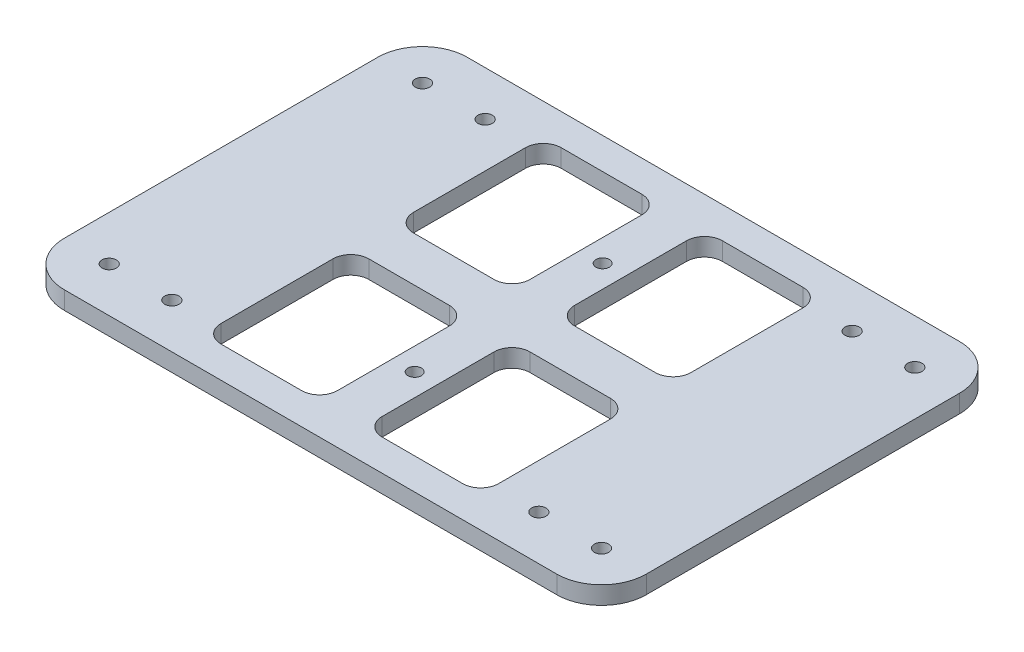
from build123d import *

# Parameters (mm, degrees)
SKETCH2_W           = 130
SKETCH2_H           = 90
BOSS_EXTRUDE1_DEPTH = 4
SKETCH3_R           = 1.5
CUT_EXTRUDE1_DEPTH  = 10
SKETCH4_R           = 1.6
CUT_EXTRUDE2_DEPTH  = 10
FILLET1_R           = 10
CUT_EXTRUDE3_DEPTH  = 10
SKETCH6_R           = 1.5
BOSS_EXTRUDE2_DEPTH = 4
SKETCH7_R           = 1.5
CUT_EXTRUDE4_DEPTH  = 10


with BuildPart() as part:
    # Sketch2 → Boss-Extrude1 (new body)
    with BuildSketch(Plane(origin=(0, 0, 0), x_dir=(1, 0, 0), z_dir=(0, 1, 0))):
        with Locations((71.271186441, 55.564971751)):
            Rectangle(SKETCH2_W, SKETCH2_H)
    extrude(amount=-BOSS_EXTRUDE1_DEPTH)

    # Sketch3 → Cut-Extrude1 (cut)
    with BuildSketch(Plane(origin=(0, 0, 0), x_dir=(1, 0, 0), z_dir=(0, 1, 0))):
        with Locations(Location((126.271186441, 63.564971751, 0), (0, 0, 270))):
            Circle(SKETCH3_R)
        with Locations(Location((126.271186441, 47.564971751, 0), (0, 0, 270))):
            Circle(SKETCH3_R)
        with Locations(Location((112.271186441, 47.564971751, 0), (0, 0, 270))):
            Circle(SKETCH3_R)
        with Locations(Location((112.271186441, 63.564971751, 0), (0, 0, 270))):
            Circle(SKETCH3_R)
        with Locations(Location((16.271186441, 47.564971751, 0), (0, 0, 90))):
            Circle(SKETCH3_R)
        with Locations(Location((30.271186441, 47.564971751, 0), (0, 0, 90))):
            Circle(SKETCH3_R)
        with Locations(Location((16.271186441, 63.564971751, 0), (0, 0, 90))):
            Circle(SKETCH3_R)
        with Locations(Location((30.271186441, 63.564971751, 0), (0, 0, 90))):
            Circle(SKETCH3_R)
    extrude(amount=-CUT_EXTRUDE1_DEPTH, mode=Mode.SUBTRACT)

    # Sketch4 → Cut-Extrude2 (cut)
    with BuildSketch(Plane(origin=(0, 0, 0), x_dir=(1, 0, 0), z_dir=(0, 1, 0))):
        with Locations(Location((16.271186441, 20.564971751, 0), (0, 0, 270))):
            Circle(SKETCH4_R)
        with Locations(Location((30.271186441, 20.564971751, 0), (0, 0, 270))):
            Circle(SKETCH4_R)
        with Locations(Location((30.271186441, 90.564971751, 0), (0, 0, 90))):
            Circle(SKETCH4_R)
        with Locations(Location((16.271186441, 90.564971751, 0), (0, 0, 90))):
            Circle(SKETCH4_R)
        with Locations(Location((112.271186441, 20.564971751, 0), (0, 0, 90))):
            Circle(SKETCH4_R)
        with Locations(Location((126.271186441, 20.564971751, 0), (0, 0, 90))):
            Circle(SKETCH4_R)
        with Locations(Location((126.271186441, 90.564971751, 0), (0, 0, 270))):
            Circle(SKETCH4_R)
        with Locations(Location((112.271186441, 90.564971751, 0), (0, 0, 270))):
            Circle(SKETCH4_R)
    extrude(amount=-CUT_EXTRUDE2_DEPTH, mode=Mode.SUBTRACT)

    # Fillet1
    fillet1_edges = [part.edges().sort_by_distance(p)[0] for p in [
        (6.271186441, -2, -100.564971751),
        (136.271186441, -2, -100.564971751),
        (136.271186441, -2, -10.564971751),
        (6.271186441, -2, -10.564971751),
    ]]
    fillet(fillet1_edges, radius=FILLET1_R)

    # Sketch5 → Cut-Extrude3 (cut)
    with BuildSketch(Plane(origin=(0, 0, 0), x_dir=(1, 0, 0), z_dir=(0, 1, 0))):
        with BuildLine():
            Line((76.271186441, 89.564971751), (76.271186441, 64.564971751))
            ThreePointArc((76.271186441, 64.564971751), (77.442759316, 61.736544627), (80.271186441, 60.564971751))
            Line((80.271186441, 60.564971751), (98.271186441, 60.564971751))
            ThreePointArc((98.271186441, 60.564971751), (101.099613565, 61.736544627), (102.271186441, 64.564971751))
            Line((102.271186441, 64.564971751), (102.271186441, 89.564971751))
            ThreePointArc((102.271186441, 89.564971751), (101.099613565, 92.393398876), (98.271186441, 93.564971751))
            Line((98.271186441, 93.564971751), (80.271186441, 93.564971751))
            ThreePointArc((80.271186441, 93.564971751), (77.442759316, 92.393398876), (76.271186441, 89.564971751))
        make_face()
        with BuildLine():
            Line((40.271186441, 89.564971751), (40.271186441, 64.564971751))
            ThreePointArc((40.271186441, 64.564971751), (41.442759316, 61.736544627), (44.271186441, 60.564971751))
            Line((44.271186441, 60.564971751), (62.271186441, 60.564971751))
            ThreePointArc((62.271186441, 60.564971751), (65.099613565, 61.736544627), (66.271186441, 64.564971751))
            Line((66.271186441, 64.564971751), (66.271186441, 89.564971751))
            ThreePointArc((66.271186441, 89.564971751), (65.099613565, 92.393398876), (62.271186441, 93.564971751))
            Line((62.271186441, 93.564971751), (44.271186441, 93.564971751))
            ThreePointArc((44.271186441, 93.564971751), (41.442759316, 92.393398876), (40.271186441, 89.564971751))
        make_face()
        with BuildLine():
            Line((66.271186441, 21.564971751), (66.271186441, 46.564971751))
            ThreePointArc((66.271186441, 46.564971751), (65.099613565, 49.393398876), (62.271186441, 50.564971751))
            Line((62.271186441, 50.564971751), (44.271186441, 50.564971751))
            ThreePointArc((44.271186441, 50.564971751), (41.442759316, 49.393398876), (40.271186441, 46.564971751))
            Line((40.271186441, 46.564971751), (40.271186441, 21.564971751))
            ThreePointArc((40.271186441, 21.564971751), (41.442759316, 18.736544627), (44.271186441, 17.564971751))
            Line((44.271186441, 17.564971751), (62.271186441, 17.564971751))
            ThreePointArc((62.271186441, 17.564971751), (65.099613565, 18.736544627), (66.271186441, 21.564971751))
        make_face()
        with BuildLine():
            Line((102.271186441, 21.564971751), (102.271186441, 46.564971751))
            ThreePointArc((102.271186441, 46.564971751), (101.099613565, 49.393398876), (98.271186441, 50.564971751))
            Line((98.271186441, 50.564971751), (80.271186441, 50.564971751))
            ThreePointArc((80.271186441, 50.564971751), (77.442759316, 49.393398876), (76.271186441, 46.564971751))
            Line((76.271186441, 46.564971751), (76.271186441, 21.564971751))
            ThreePointArc((76.271186441, 21.564971751), (77.442759316, 18.736544627), (80.271186441, 17.564971751))
            Line((80.271186441, 17.564971751), (98.271186441, 17.564971751))
            ThreePointArc((98.271186441, 17.564971751), (101.099613565, 18.736544627), (102.271186441, 21.564971751))
        make_face()
    extrude(amount=-CUT_EXTRUDE3_DEPTH, mode=Mode.SUBTRACT)

    # Sketch6 → Boss-Extrude2 (add)
    with BuildSketch(Plane(origin=(0, 0, 0), x_dir=(1, 0, 0), z_dir=(0, 1, 0))):
        with Locations((30.271186441, 63.564971751)):
            Circle(SKETCH6_R)
        with Locations((30.271186441, 47.564971751)):
            Circle(SKETCH6_R)
        with Locations((16.271186441, 47.564971751)):
            Circle(SKETCH6_R)
        with Locations((16.271186441, 63.564971751)):
            Circle(SKETCH6_R)
        with Locations((112.271186441, 63.564971751)):
            Circle(SKETCH6_R)
        with Locations((126.271186441, 63.564971751)):
            Circle(SKETCH6_R)
        with Locations((126.271186441, 47.564971751)):
            Circle(SKETCH6_R)
        with Locations((112.271186441, 47.564971751)):
            Circle(SKETCH6_R)
    extrude(amount=-BOSS_EXTRUDE2_DEPTH)

    # Sketch7 → Cut-Extrude4 (cut)
    with BuildSketch(Plane(origin=(0, 0, 0), x_dir=(1, 0, 0), z_dir=(0, 1, 0))):
        with Locations(Location((71.271186441, 75.814971751, 0), (0, 0, 270))):
            Circle(SKETCH7_R)
        with Locations(Location((71.271186441, 33.814971751, 0), (0, 0, 270))):
            Circle(SKETCH7_R)
    extrude(amount=-CUT_EXTRUDE4_DEPTH, mode=Mode.SUBTRACT)


solid = part.part
